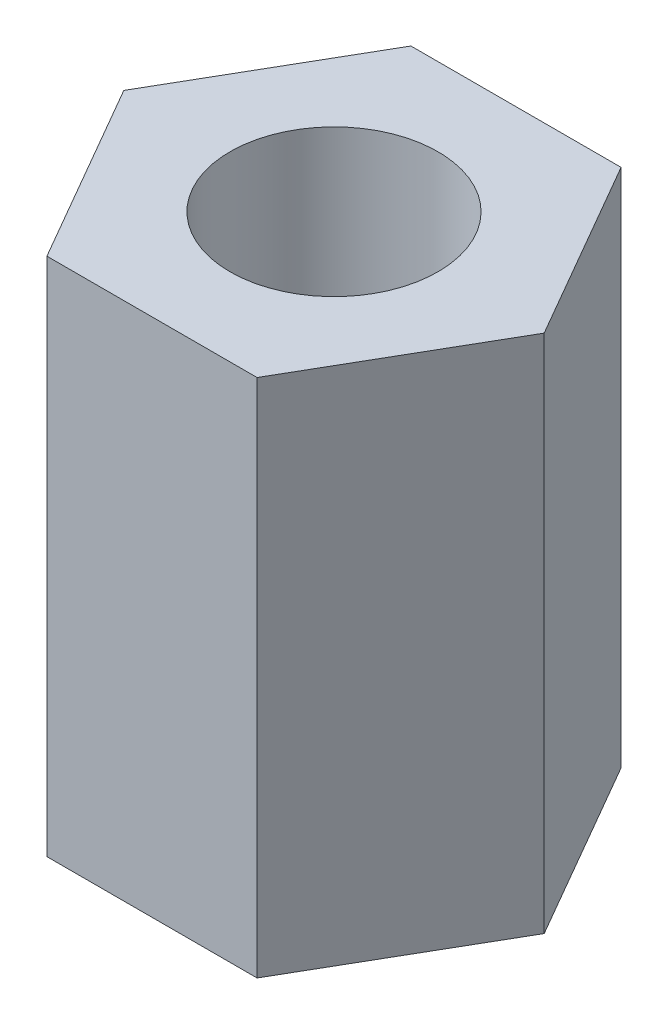
from build123d import *

# Parameters (mm, degrees)
SKETCH_1_R      = 2
EXTRUDE_1_DEPTH = 10


with BuildPart() as part:
    # 草图1 → 凸台-拉伸1 (new body)
    with BuildSketch(Plane(origin=(0, 0, 0), x_dir=(1, 0, 0), z_dir=(0, 1, 0))):
        Polygon((4.041451884, 0), (2.020725942, 3.5), (-2.020725942, 3.5), (-4.041451884, 0), (-2.020725942, -3.5), (2.020725942, -3.5), align=None)
        with Locations(Location((0, 0, 0), (0, 0, 270))):
            Circle(SKETCH_1_R, mode=Mode.SUBTRACT)
    extrude(amount=EXTRUDE_1_DEPTH)


solid = part.part
